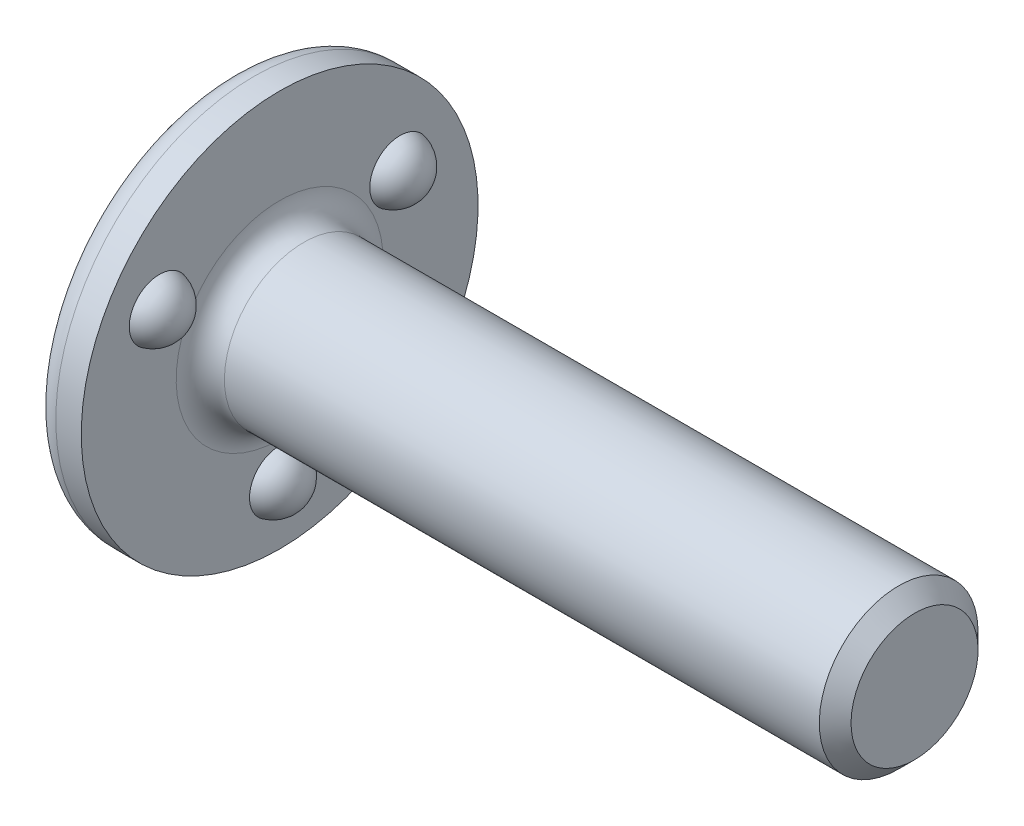
from build123d import *

# Parameters (mm, degrees)
CHAMFER1_SIZE     = 0.635
CIRPATTERN1_COUNT = 3
FILLET1_R         = 0.9652


with BuildPart() as part:
    # Sketch1 → Revolve1 (revolve)
    with BuildSketch(Plane.XY, mode=Mode.PRIVATE) as revolve1_sk:
        Polygon((0, 0), (0, 7.9375), (1.984375, 7.9375), (1.984375, 3.175), (27.384375, 3.175), (27.384375, 0), align=None)
    revolve(revolve1_sk.sketch.rotate(Axis((0, 0, 0), (1, 0, 0)), 180), axis=Axis((0, 0, 0), (1, 0, 0)))

    # Chamfer1
    chamfer1_edges = [part.edges().sort_by_distance(p)[0] for p in [
        (27.384375, 3.175, 0),
    ]]
    chamfer(chamfer1_edges, length=CHAMFER1_SIZE)

    # Sketch2 → Revolve2 (revolve)
    with BuildSketch(Plane.XY, mode=Mode.PRIVATE) as revolve2_sk:
        with BuildLine():
            Line((1.984375, -5.55625), (2.949575, -5.55625))
            ThreePointArc((2.949575, -5.55625), (2.678583674, -4.783713061), (1.984375, -4.34975))
            Line((1.984375, -4.34975), (1.984375, -5.55625))
        make_face()
    revolve2 = revolve(revolve2_sk.sketch.rotate(Axis((1.984375, -5.55625, 0), (-1, 0, 0)), 180), axis=Axis((1.984375, -5.55625, 0), (-1, 0, 0)))

    # CirPattern1: Revolve2 ×3 about axis
    cirpattern1_axis = Axis((0, 0, 0), (1, 0, 0))
    for i in range(1, CIRPATTERN1_COUNT):
        add(revolve2.rotate(cirpattern1_axis, i * 360 / CIRPATTERN1_COUNT))

    # Fillet1
    fillet1_edges = [part.edges().sort_by_distance(p)[0] for p in [
        (1.984375, 3.175, 0),
        (0, 7.9375, 0),
    ]]
    fillet(fillet1_edges, radius=FILLET1_R)


solid = part.part
